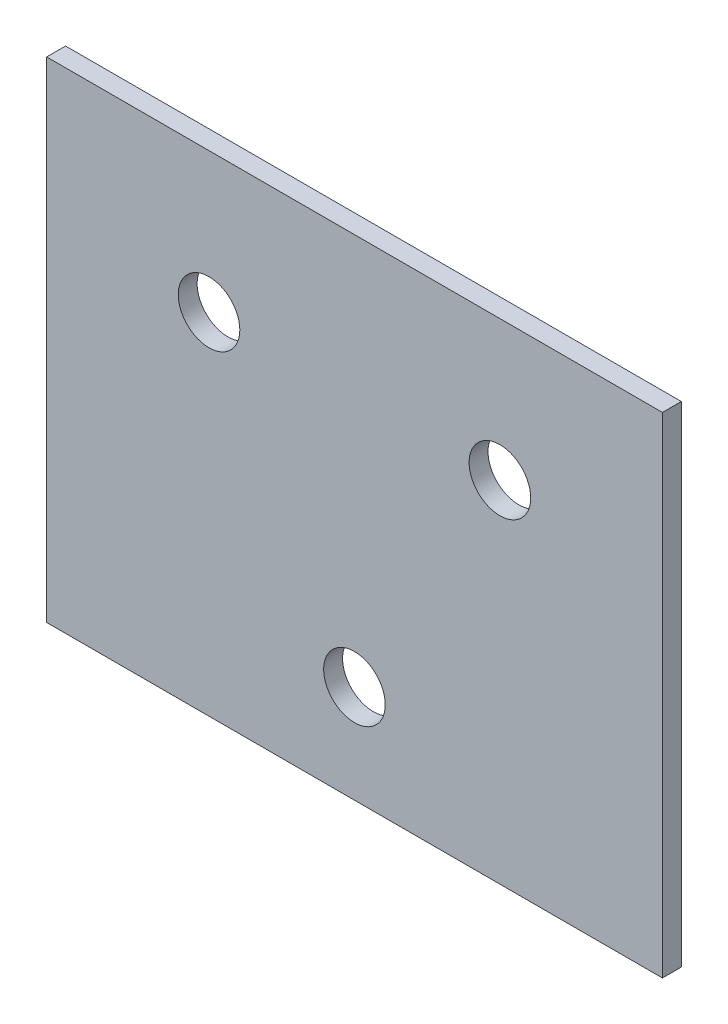
from build123d import *

# Parameters (mm, degrees)
SKETCH6_W           = 220
SKETCH6_H           = 175
SKETCH6_R           = 11
SKETCH6_R_2         = 24
BOSS_EXTRUDE1_DEPTH = 6.75


with BuildPart() as part:
    # Sketch6 → Boss-Extrude1 (new body)
    # profile 1 of 2: a face of its own
    with BuildSketch(Plane.XY):
        with Locations((-459.776309557, -210.085944494)):
            Rectangle(SKETCH6_W, SKETCH6_H)
        with Locations((-459.807870528, -262.585944494)):
            Circle(SKETCH6_R, mode=Mode.SUBTRACT)
        with Locations((-407.846346301, -172.585944494)):
            Circle(SKETCH6_R, mode=Mode.SUBTRACT)
        with Locations((-511.769394755, -172.585944494)):
            Circle(SKETCH6_R, mode=Mode.SUBTRACT)
        with Locations((-459.807870528, -202.585944494)):
            Circle(SKETCH6_R_2, mode=Mode.SUBTRACT)
    # profile 2 of 2: a face of its own
    with BuildSketch(Plane.XY):
        with Locations((-459.807870528, -202.585944494)):
            Circle(SKETCH6_R_2)
    extrude(amount=BOSS_EXTRUDE1_DEPTH)


solid = part.part
